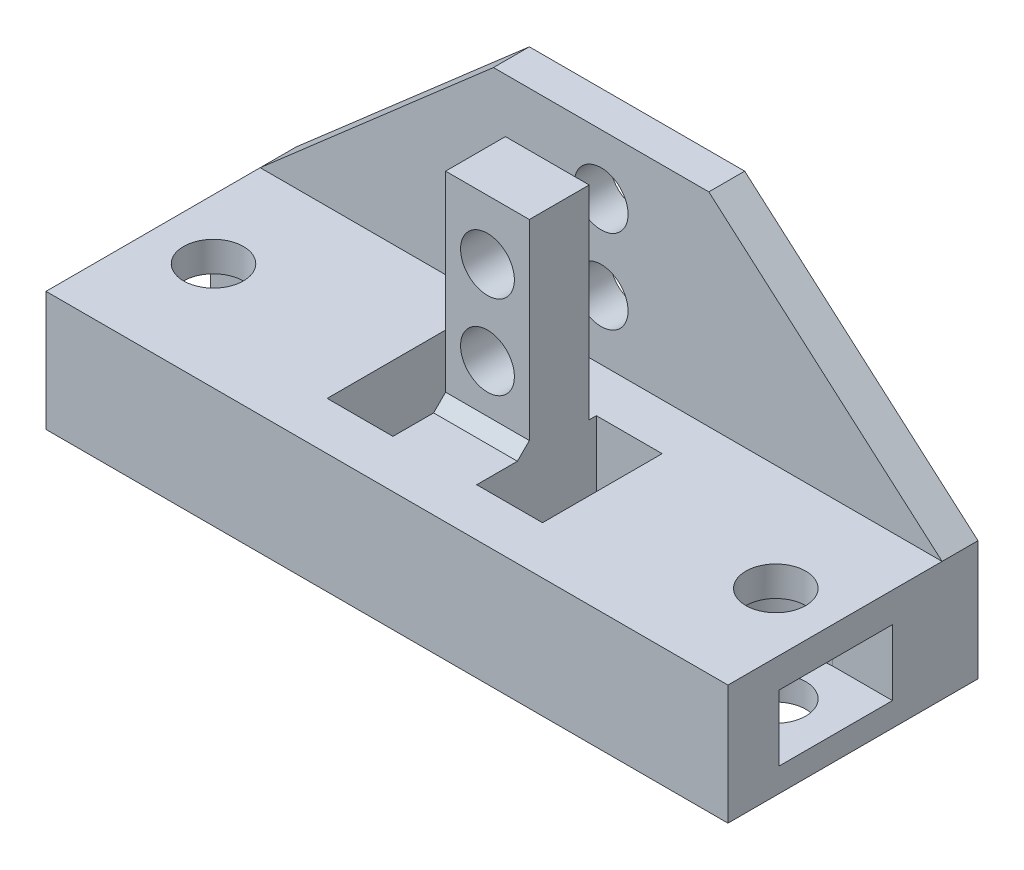
from build123d import *

# Parameters (mm, degrees)
ESQUISSE1_W              = 20
ESQUISSE1_H              = 17
ESQUISSE1_R              = 2.1
BOSS_EXTRU_1_DEPTH       = 5
ESQUISSE2_W              = 18
ESQUISSE2_H              = 4.4
BOSS_EXTRU_3_DEPTH       = 10
ESQUISSE5_W              = 6.5
ESQUISSE5_H              = 17
ENL_V_MAT_EXTRU_3_DEPTH  = 18
BOSS_EXTRU_6_DEPTH       = 8.4
BOSS_EXTRU_6_DEPTH_BACK  = 10
ESQUISSE10_W             = 7
ESQUISSE10_H             = 10
ESQUISSE11_W             = 5.5
ESQUISSE11_H             = 2.5
ESQUISSE11_W_2           = 7
ESQUISSE11_H_2           = 0.5
BOSS_EXTRU_7_DEPTH       = 17
ESQUISSE12_W             = 18
ESQUISSE12_H             = 2.5
BOSS_EXTRU_8_DEPTH       = 10
ESQUISSE20_R             = 2.25
ENL_V_MAT_EXTRU_7_DEPTH  = 18
ESQUISSE21_W             = 4
ESQUISSE21_H             = 10
ESQUISSE21_W_2           = 6.9
BOSS_EXTRU_9_DEPTH       = 25
ESQUISSE22_W             = 19.5
ESQUISSE22_H             = 10
BOSS_EXTRU_10_DEPTH      = 14
BOSS_EXTRU_11_DEPTH      = 3
CHANFREIN1_SIZE          = 1
ESQUISSE29_R             = 2.5
ENL_V_MAT_EXTRU_11_DEPTH = 10
ENL_V_START              = -7.5
ESQUISSE30_R             = 4.75
ESQUISSE30_R_2           = 2.5
ENL_V_MAT_EXTRU_12_DEPTH = 5.5


with BuildPart() as part:
    # Esquisse1 → Boss.-Extru.1 (new body)
    with BuildSketch(Plane.XY):
        with Locations((10, 8.5)):
            Rectangle(ESQUISSE1_W, ESQUISSE1_H)
        with Locations((10, 5)):
            Circle(ESQUISSE1_R, mode=Mode.SUBTRACT)
        with Locations((10, 12)):
            Circle(ESQUISSE1_R, mode=Mode.SUBTRACT)
    extrude(amount=BOSS_EXTRU_1_DEPTH)

    # Esquisse5 → Enlèv. mat.-Extru.3 (cut)
    with BuildSketch(Plane.XY.offset(5)):
        with Locations((16.75, 8.5)):
            Rectangle(ESQUISSE5_W, ESQUISSE5_H)
        with Locations((3.25, 8.5)):
            Rectangle(ESQUISSE5_W, ESQUISSE5_H)
    extrude(amount=-ENL_V_MAT_EXTRU_3_DEPTH, mode=Mode.SUBTRACT)



with BuildPart() as body_2:
    # Esquisse2 → Boss.-Extru.3 (new body)
    with BuildSketch(Plane.XZ):
        with Locations((10, -2.8)):
            Rectangle(ESQUISSE2_W, ESQUISSE2_H)
    extrude(amount=BOSS_EXTRU_3_DEPTH)


with BuildPart() as part_1:
    add(part.part)

    add(body_2.part)  # Boss.-Extru.6 merges body 2
    # Esquisse10 → Boss.-Extru.6 (add, two sides: drawn at the far end of the back side and taken through both)
    with BuildSketch(Plane.XY.offset(5).offset(-BOSS_EXTRU_6_DEPTH_BACK)):
        with Locations((10, -5)):
            Rectangle(ESQUISSE10_W, ESQUISSE10_H)
    extrude(amount=BOSS_EXTRU_6_DEPTH + BOSS_EXTRU_6_DEPTH_BACK)

    # Esquisse11 → Boss.-Extru.7 (add)
    with BuildSketch(Plane(origin=(0, 0, 0), x_dir=(1, 0, 0), z_dir=(0, 1, 0))):
        with Locations((3.75, 6.25)):
            Rectangle(ESQUISSE11_W, ESQUISSE11_H)
        with Locations((10, 6.25)):
            Rectangle(ESQUISSE11_W_2, ESQUISSE11_H)
        with Locations((16.25, 6.25)):
            Rectangle(ESQUISSE11_W, ESQUISSE11_H)
        with Locations((3.75, 4.75)):
            Rectangle(ESQUISSE11_W, ESQUISSE11_H_2)
        with Locations((10, 4.75)):
            Rectangle(ESQUISSE11_W_2, ESQUISSE11_H_2)
        with Locations((16.25, 4.75)):
            Rectangle(ESQUISSE11_W, ESQUISSE11_H_2)
    extrude(amount=BOSS_EXTRU_7_DEPTH)

    # Esquisse12 → Boss.-Extru.8 (add)
    with BuildSketch(Plane.XZ):
        with Locations((10, -6.25)):
            Rectangle(ESQUISSE12_W, ESQUISSE12_H)
    extrude(amount=BOSS_EXTRU_8_DEPTH)

    # Esquisse20 → Enlèv. mat.-Extru.7 (cut)
    with BuildSketch(Plane.XY.offset(5)):
        with Locations((10, 5)):
            Circle(ESQUISSE20_R)
        with Locations((10, 12)):
            Circle(ESQUISSE20_R)
    extrude(amount=-ENL_V_MAT_EXTRU_7_DEPTH, mode=Mode.SUBTRACT)

    # Esquisse21 → Boss.-Extru.9 (add)
    with BuildSketch(Plane(origin=(13.5, 0, 0), x_dir=(0, 0, -1), z_dir=(1, 0, 0))):
        with Locations((-11.4, -5)):
            Rectangle(ESQUISSE21_W, ESQUISSE21_H)
        with Locations((4.05, -5)):
            Rectangle(ESQUISSE21_W_2, ESQUISSE21_H)
    boss_extru_9 = extrude(amount=BOSS_EXTRU_9_DEPTH)

    # Esquisse22 → Boss.-Extru.10 (add)
    with BuildSketch(Plane.XY.offset(-0.6)):
        with Locations((28.75, -5)):
            Rectangle(ESQUISSE22_W, ESQUISSE22_H)
    boss_extru_10 = extrude(amount=BOSS_EXTRU_10_DEPTH)

    # Esquisse24 → Boss.-Extru.11 (add)
    with BuildSketch(Plane(origin=(0, 0, -7.5), x_dir=(-1, 0, 0), z_dir=(0, 0, -1))):
        Polygon((-38.5, 0), (-19, 0), (-19, 17), align=None)
    boss_extru_11 = extrude(amount=-BOSS_EXTRU_11_DEPTH)

    # Symétrie1: Boss.-Extru.9, Boss.-Extru.10, Boss.-Extru.11 across plane
    add(boss_extru_9.mirror(Plane.ZY.offset(-10)))
    add(boss_extru_10.mirror(Plane.ZY.offset(-10)))
    add(boss_extru_11.mirror(Plane.ZY.offset(-10)))

    # Chanfrein1
    chanfrein1_edges = [part_1.edges().sort_by_distance(p)[0] for p in [
        (10, 0, 5),
    ]]
    chamfer(chanfrein1_edges, length=CHANFREIN1_SIZE)

    # Esquisse29 → Enlèv. mat.-Extru.11 (cut)
    with BuildSketch(Plane(origin=(0, 0, 0), x_dir=(1, 0, 0), z_dir=(0, 1, 0))):
        with Locations(Location((-13.5, -4.4, 0), (0, 0, 270))):
            Circle(ESQUISSE29_R)
        with Locations(Location((33.5, -4.4, 0), (0, 0, 270))):
            Circle(ESQUISSE29_R)
    extrude(amount=-ENL_V_MAT_EXTRU_11_DEPTH, mode=Mode.SUBTRACT)

    # Esquisse30 → Enlèv. mat.-Extru.12 (cut)
    # profile 1 of 2: a face of its own
    with BuildSketch(Plane(origin=(0, -10, 0), x_dir=(-1, 0, 0), z_dir=(0, -1, 0)).offset(ENL_V_START)):
        with Locations((13.5, -4.4)):
            Circle(ESQUISSE30_R)
        with Locations(Location((13.5, -4.4, 0), (0, 0, 270))):
            Circle(ESQUISSE30_R_2, mode=Mode.SUBTRACT)
    # profile 2 of 2: a face of its own
    with BuildSketch(Plane(origin=(0, -10, 0), x_dir=(-1, 0, 0), z_dir=(0, -1, 0)).offset(ENL_V_START)):
        with BuildLine():
            ThreePointArc((18.25, -4.4), (16.858757211, -7.758757211), (13.5, -9.15))
            Line((13.5, -9.15), (18.5, -9.15))
            Line((18.5, -9.15), (18.5, 0.35))
            Line((18.5, 0.35), (13.5, 0.35))
            ThreePointArc((13.5, 0.35), (16.858757211, -1.041242789), (18.25, -4.4))
        make_face()
    enl_v_mat_extru_12 = extrude(amount=ENL_V_MAT_EXTRU_12_DEPTH, mode=Mode.SUBTRACT)

    # Symétrie3: Enlèv. mat.-Extru.12 across plane
    add(enl_v_mat_extru_12.mirror(Plane.ZY.offset(-10)), mode=Mode.SUBTRACT)


solid = part_1.part
